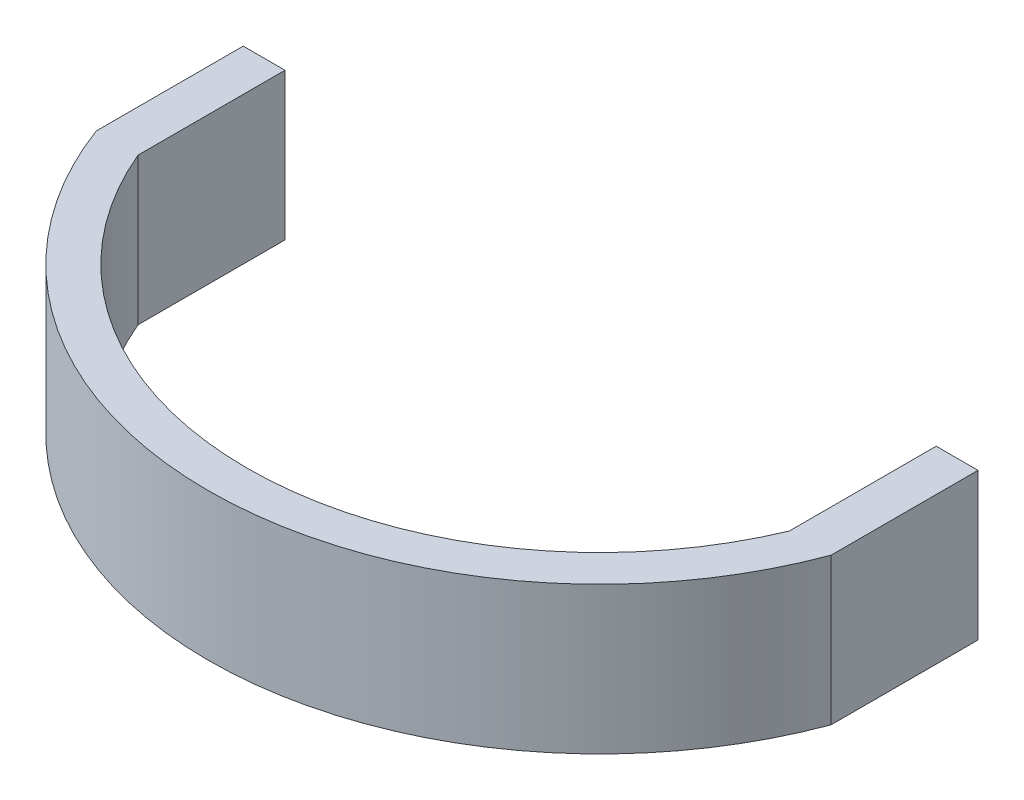
from build123d import *

# Parameters (mm, degrees)
BOSS_EXTRUDE1_DEPTH = 1.5


with BuildPart() as part:
    # Sketch1 → Boss-Extrude1 (new, symmetric)
    with BuildSketch(Plane(origin=(0, 0, 0), x_dir=(1, 0, 0), z_dir=(0, 1, 0))):
        with BuildLine():
            Line((-7.5, -2.783882181), (-7.5, 0.216117819))
            Line((-7.5, 0.216117819), (-6.646806682, 0.216117819))
            Line((-6.646806682, 0.216117819), (-6.646806682, -2.783882181))
            ThreePointArc((-6.646806682, -2.783882181), (0, -7.20625), (6.646806682, -2.783882181))
            Line((6.646806682, -2.783882181), (6.646806682, 0.216117819))
            Line((6.646806682, 0.216117819), (7.5, 0.216117819))
            Line((7.5, 0.216117819), (7.5, -2.783882181))
            ThreePointArc((7.5, -2.783882181), (0, -8), (-7.5, -2.783882181))
        make_face()
    extrude(amount=BOSS_EXTRUDE1_DEPTH, both=True)


solid = part.part
